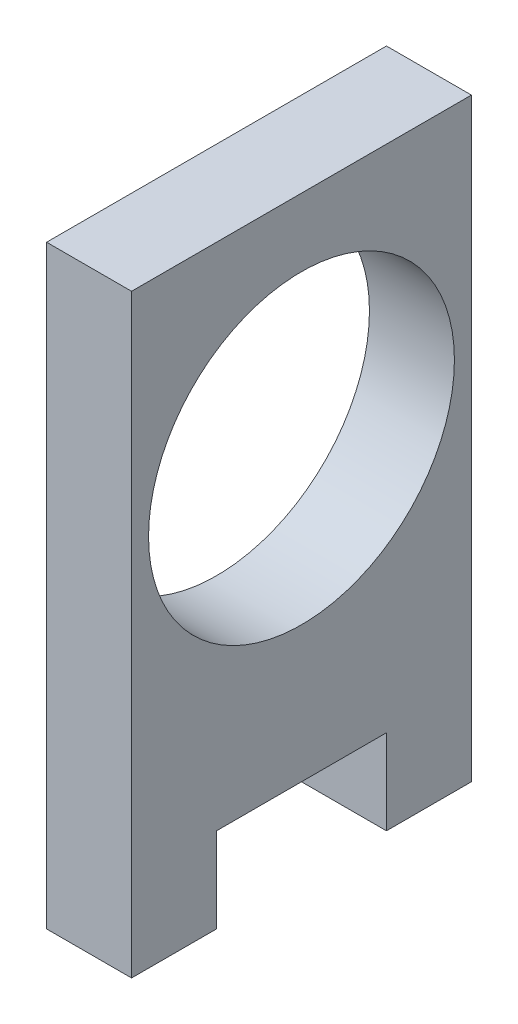
from build123d import *

# Parameters (mm, degrees)
SKETCH1_W           = 6.35
SKETCH1_H           = 6.35
BOSS_EXTRUDE1_DEPTH = 6.35


with BuildPart() as part:
    # Sketch1 → Boss-Extrude1 (new body)
    with BuildSketch(Plane(origin=(0, 0, 0), x_dir=(0, 0, -1), z_dir=(1, 0, 0))):
        with Locations((22.225, -3.175)):
            Rectangle(SKETCH1_W, SKETCH1_H)
        with BuildLine():
            Line((25.4, 38.1), (12.7, 38.1))
            Line((12.7, 38.1), (12.7, 33.02))
            ThreePointArc((12.7, 33.02), (20.782230509, 29.672230509), (24.13, 21.59))
            ThreePointArc((24.13, 21.59), (20.782230509, 13.507769491), (12.7, 10.16))
            Line((12.7, 10.16), (12.7, 0))
            Line((12.7, 0), (19.05, 0))
            Line((19.05, 0), (25.4, 0))
            Line((25.4, 0), (25.4, 38.1))
        make_face()
        with BuildLine():
            Line((12.7, 33.02), (12.7, 38.1))
            Line((12.7, 38.1), (0, 38.1))
            Line((0, 38.1), (0, 0))
            Line((0, 0), (6.35, 0))
            Line((6.35, 0), (12.7, 0))
            Line((12.7, 0), (12.7, 10.16))
            ThreePointArc((12.7, 10.16), (1.27, 21.59), (12.7, 33.02))
        make_face()
        with Locations((3.175, -3.175)):
            Rectangle(SKETCH1_W, SKETCH1_H)
    extrude(amount=BOSS_EXTRUDE1_DEPTH)


solid = part.part
